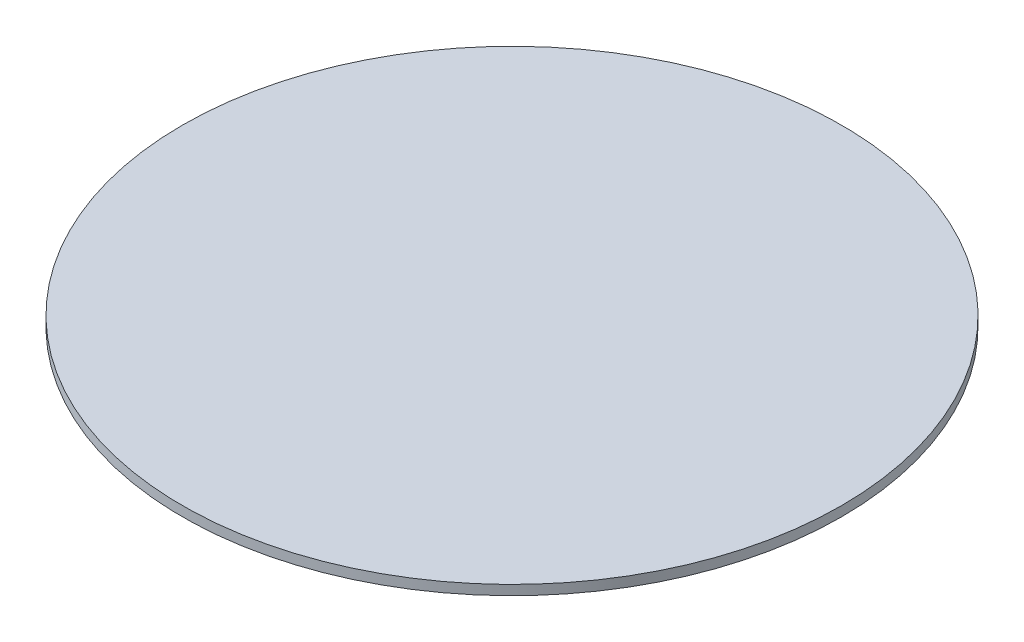
from build123d import *

# Parameters (mm, degrees)
SKETCH1_W = 67.5
SKETCH1_H = 2


with BuildPart() as part:
    # Sketch1 → Revolve1 (revolve)
    with BuildSketch(Plane.XY):
        with Locations((-33.75, 19.5)):
            Rectangle(SKETCH1_W, SKETCH1_H)
    revolve(axis=Axis((0, 20.5, 0), (0, -1, 0)))


solid = part.part
